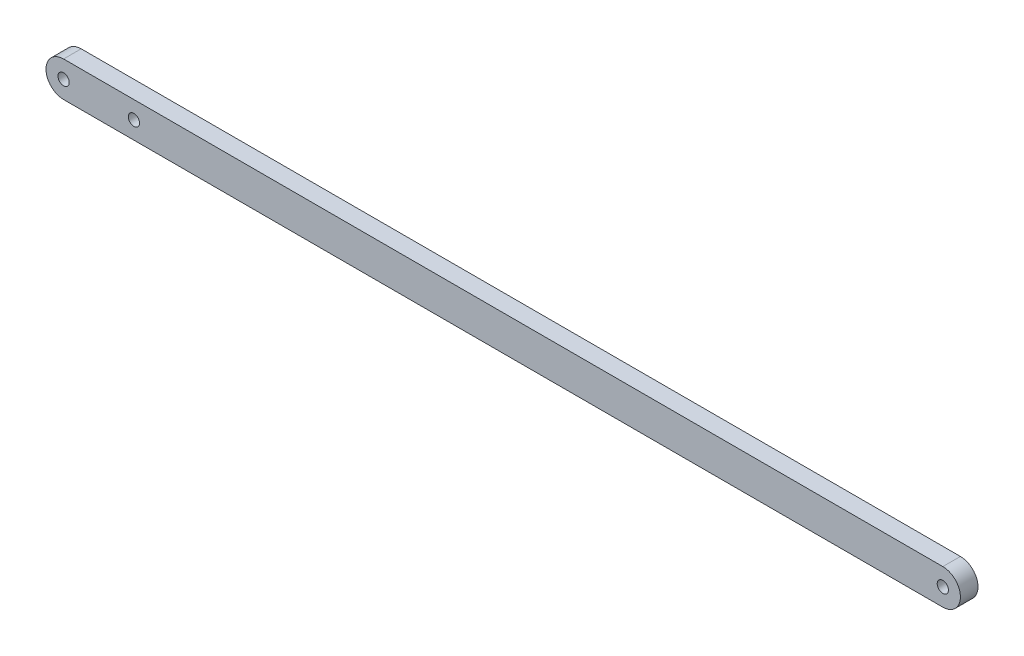
from build123d import *

# Parameters (mm, degrees)
SKETCH1_R           = 2.032
BOSS_EXTRUDE1_DEPTH = 3.175


with BuildPart() as part:
    # Sketch1 → Boss-Extrude1 (new, symmetric)
    with BuildSketch(Plane.XY):
        with BuildLine():
            Line((0, 6.35), (317.5, 6.35))
            ThreePointArc((317.5, 6.35), (323.85, 0), (317.5, -6.35))
            Line((317.5, -6.35), (0, -6.35))
            ThreePointArc((0, -6.35), (-6.35, 0), (0, 6.35))
        make_face()
        Circle(SKETCH1_R, mode=Mode.SUBTRACT)
        with Locations((317.5, 0)):
            Circle(SKETCH1_R, mode=Mode.SUBTRACT)
        with Locations((25.4, 0)):
            Circle(SKETCH1_R, mode=Mode.SUBTRACT)
    extrude(amount=BOSS_EXTRUDE1_DEPTH, both=True)


solid = part.part
